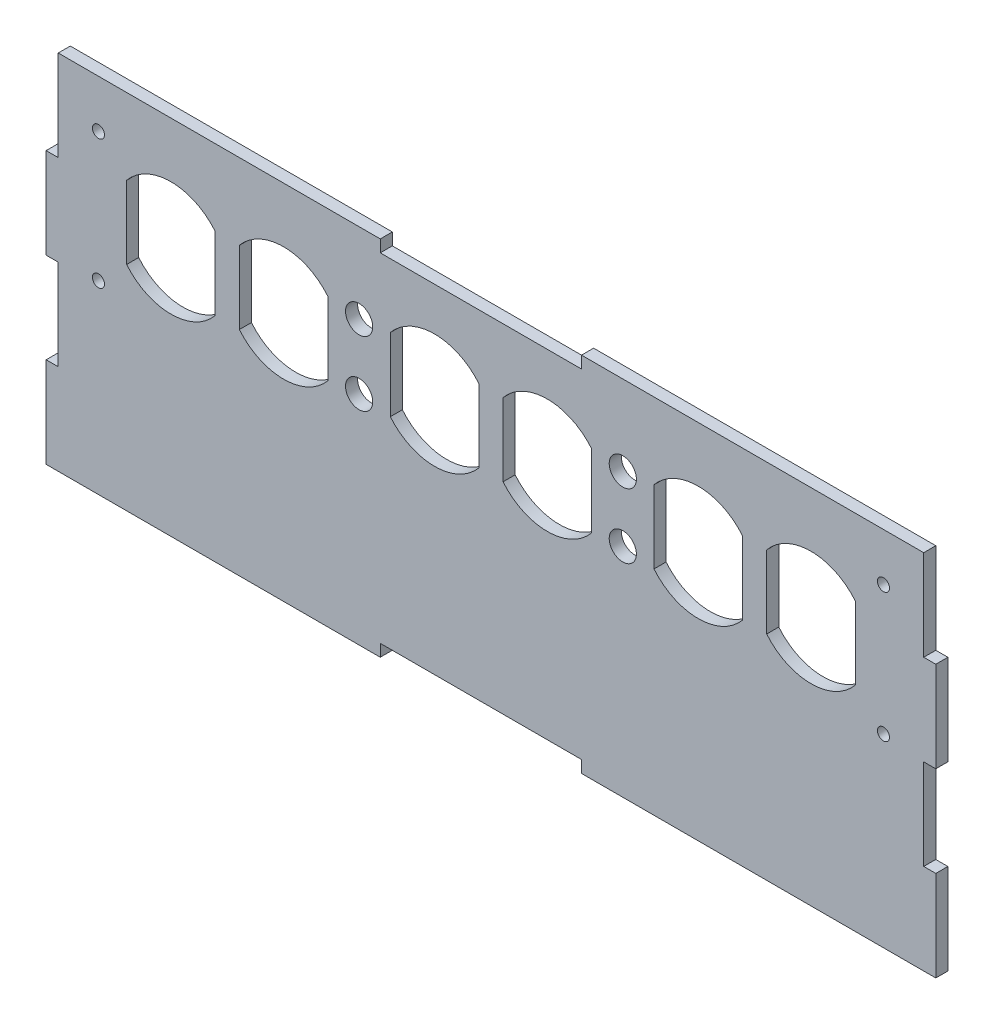
from build123d import *

# Parameters (mm, degrees)
SKETCH1_R           = 1.5
SKETCH1_R_2         = 3.375
BOSS_EXTRUDE1_DEPTH = 3


with BuildPart() as part:
    # Sketch1 → Boss-Extrude1 (new body)
    with BuildSketch(Plane.XY):
        Polygon((213, -20.5), (213, 2), (216, 2), (216, 24.5), (213, 24.5), (213, 47), (128, 47), (128, 44), (78, 44), (78, 47), (-2, 47), (-2, 24.5), (-5, 24.5), (-5, 2), (-2, 2), (-2, -20.5), (-5, -20.5), (-5, -43), (-2, -43), (78, -43), (78, -40), (128, -40), (128, -43), (213, -43), (216, -43), (216, -20.5), align=None)
        with Locations((8, 35.117670932)):
            Circle(SKETCH1_R, mode=Mode.SUBTRACT)
        with Locations((8, 3)):
            Circle(SKETCH1_R, mode=Mode.SUBTRACT)
        with Locations((203, 3)):
            Circle(SKETCH1_R, mode=Mode.SUBTRACT)
        with Locations((203, 35.117670932)):
            Circle(SKETCH1_R, mode=Mode.SUBTRACT)
        with Locations((72.75, 27.117670932)):
            Circle(SKETCH1_R_2, mode=Mode.SUBTRACT)
        with Locations((72.75, 11)):
            Circle(SKETCH1_R_2, mode=Mode.SUBTRACT)
        with Locations((138.25, 27.117670932)):
            Circle(SKETCH1_R_2, mode=Mode.SUBTRACT)
        with Locations((138.25, 11)):
            Circle(SKETCH1_R_2, mode=Mode.SUBTRACT)
        with BuildLine():
            Line((15, 10), (15, 28.117670932))
            ThreePointArc((15, 28.117670932), (26, 33.308835466), (37, 28.117670932))
            Line((37, 28.117670932), (37, 10))
            ThreePointArc((37, 10), (26, 4.808835466), (15, 10))
        make_face(mode=Mode.SUBTRACT)
        with BuildLine():
            Line((43, 10), (43, 28.117670932))
            ThreePointArc((43, 28.117670932), (54, 33.308835466), (65, 28.117670932))
            Line((65, 28.117670932), (65, 10))
            ThreePointArc((65, 10), (54, 4.808835466), (43, 10))
        make_face(mode=Mode.SUBTRACT)
        with BuildLine():
            Line((80.5, 10), (80.5, 28.117670932))
            ThreePointArc((80.5, 28.117670932), (91.5, 33.308835466), (102.5, 28.117670932))
            Line((102.5, 28.117670932), (102.5, 10))
            ThreePointArc((102.5, 10), (91.5, 4.808835466), (80.5, 10))
        make_face(mode=Mode.SUBTRACT)
        with BuildLine():
            Line((108.5, 10), (108.5, 28.117670932))
            ThreePointArc((108.5, 28.117670932), (119.5, 33.308835466), (130.5, 28.117670932))
            Line((130.5, 28.117670932), (130.5, 10))
            ThreePointArc((130.5, 10), (119.5, 4.808835466), (108.5, 10))
        make_face(mode=Mode.SUBTRACT)
        with BuildLine():
            Line((146, 10), (146, 28.117670932))
            ThreePointArc((146, 28.117670932), (157, 33.308835466), (168, 28.117670932))
            Line((168, 28.117670932), (168, 10))
            ThreePointArc((168, 10), (157, 4.808835466), (146, 10))
        make_face(mode=Mode.SUBTRACT)
        with BuildLine():
            Line((174, 10), (174, 28.117670932))
            ThreePointArc((174, 28.117670932), (185, 33.308835466), (196, 28.117670932))
            Line((196, 28.117670932), (196, 10))
            ThreePointArc((196, 10), (185, 4.808835466), (174, 10))
        make_face(mode=Mode.SUBTRACT)
    extrude(amount=BOSS_EXTRUDE1_DEPTH)


solid = part.part
